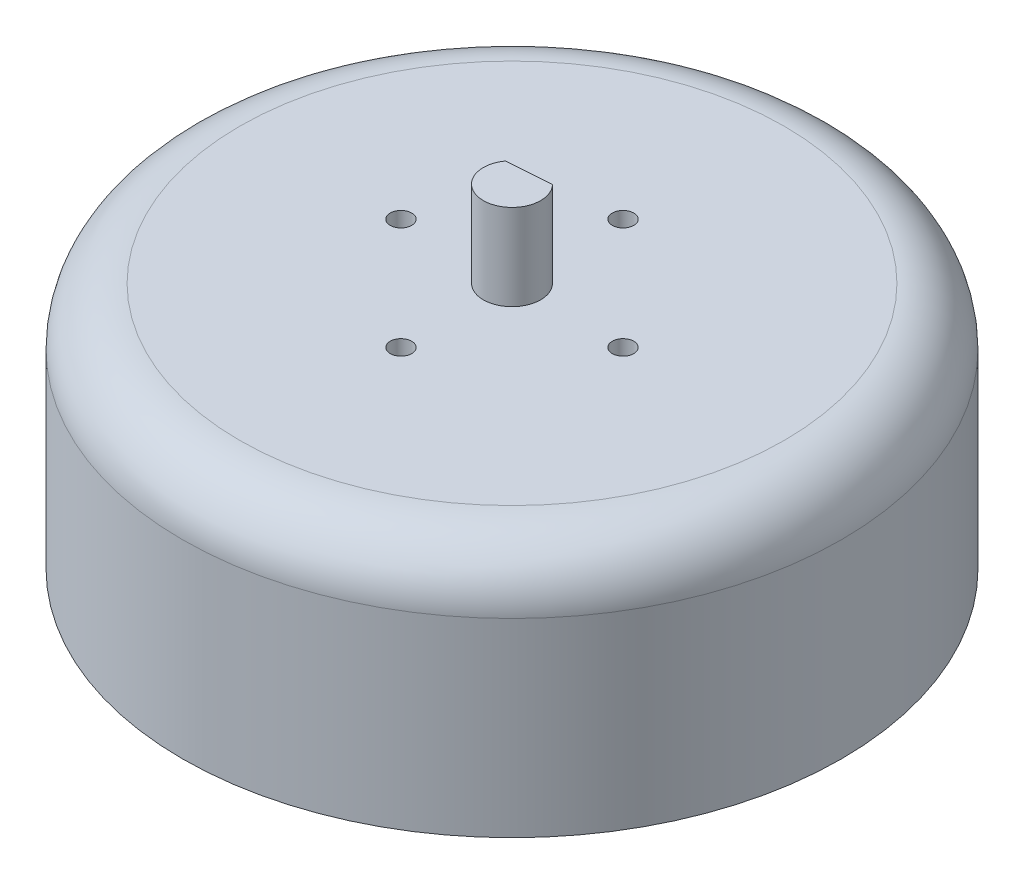
from build123d import *

# Parameters (mm, degrees)
SKETCH1_R           = 46
BOSS_EXTRUDE1_DEPTH = 38.5
SKETCH4_R           = 4
BOSS_EXTRUDE2_DEPTH = 12
SKETCH5_R           = 1.5
CUT_EXTRUDE1_DEPTH  = 6
CUT_EXTRUDE2_START  = -10
CUT_EXTRUDE2_DEPTH  = 10


with BuildPart() as part:
    # Sketch1 → Boss-Extrude1 (new body)
    with BuildSketch(Plane(origin=(0, 0, 0), x_dir=(1, 0, 0), z_dir=(0, 1, 0))):
        with Locations(Location((0, 0, 0), (0, 0, 270))):
            Circle(SKETCH1_R)
    extrude(amount=BOSS_EXTRUDE1_DEPTH)

    # Sketch2 → Cut-Revolve1 (revolve, cut)
    with BuildSketch(Plane.XY, mode=Mode.PRIVATE) as cut_revolve1_sk:
        with BuildLine():
            Line((-46, 38.5), (-46, 30.5))
            ThreePointArc((-46, 30.5), (-43.656854249, 36.156854249), (-38, 38.5))
            Line((-38, 38.5), (-46, 38.5))
        make_face()
    revolve(cut_revolve1_sk.sketch.rotate(Axis((0, 0, 0), (0, 1, 0)), 270), axis=Axis((0, 0, 0), (0, 1, 0)), mode=Mode.SUBTRACT)

    # Sketch3 → Cut-Revolve2 (revolve, cut)
    with BuildSketch(Plane.XY, mode=Mode.PRIVATE) as cut_revolve2_sk:
        Polygon((-46, 0), (-46, 4), (-31, 0), align=None)
    revolve(cut_revolve2_sk.sketch.rotate(Axis((0, 0, 0), (0, 1, 0)), 270), axis=Axis((0, 0, 0), (0, 1, 0)), mode=Mode.SUBTRACT)

    # Sketch4 → Boss-Extrude2 (add)
    with BuildSketch(Plane(origin=(0, 38.5, 0), x_dir=(1, 0, 0), z_dir=(0, 1, 0))):
        with Locations(Location((0, 0, 0), (0, 0, 270))):
            Circle(SKETCH4_R)
    extrude(amount=BOSS_EXTRUDE2_DEPTH)

    # Sketch5 → Cut-Extrude1 (cut)
    with BuildSketch(Plane(origin=(0, 38.5, 0), x_dir=(1, 0, 0), z_dir=(0, 1, 0))):
        with Locations(Location((-15.5, 0, 0), (0, 0, 270))):
            Circle(SKETCH5_R)
        with Locations(Location((0, 15.5, 0), (0, 0, 270))):
            Circle(SKETCH5_R)
        with Locations(Location((15.5, 0, 0), (0, 0, 270))):
            Circle(SKETCH5_R)
        with Locations(Location((0, -15.5, 0), (0, 0, 270))):
            Circle(SKETCH5_R)
    extrude(amount=-CUT_EXTRUDE1_DEPTH, mode=Mode.SUBTRACT)

    # Sketch6 → Cut-Extrude2 (cut)
    with BuildSketch(Plane(origin=(0, 50.5, 0), x_dir=(1, 0, 0), z_dir=(0, 1, 0)).offset(CUT_EXTRUDE2_START)):
        with BuildLine():
            Line((-3.249189343, 2.332974199), (2.894455289, 2.760820273))
            ThreePointArc((2.894455289, 2.760820273), (-0.277888697, 3.990335559), (-3.249189343, 2.332974199))
        make_face()
    extrude(amount=CUT_EXTRUDE2_DEPTH, mode=Mode.SUBTRACT)


solid = part.part
